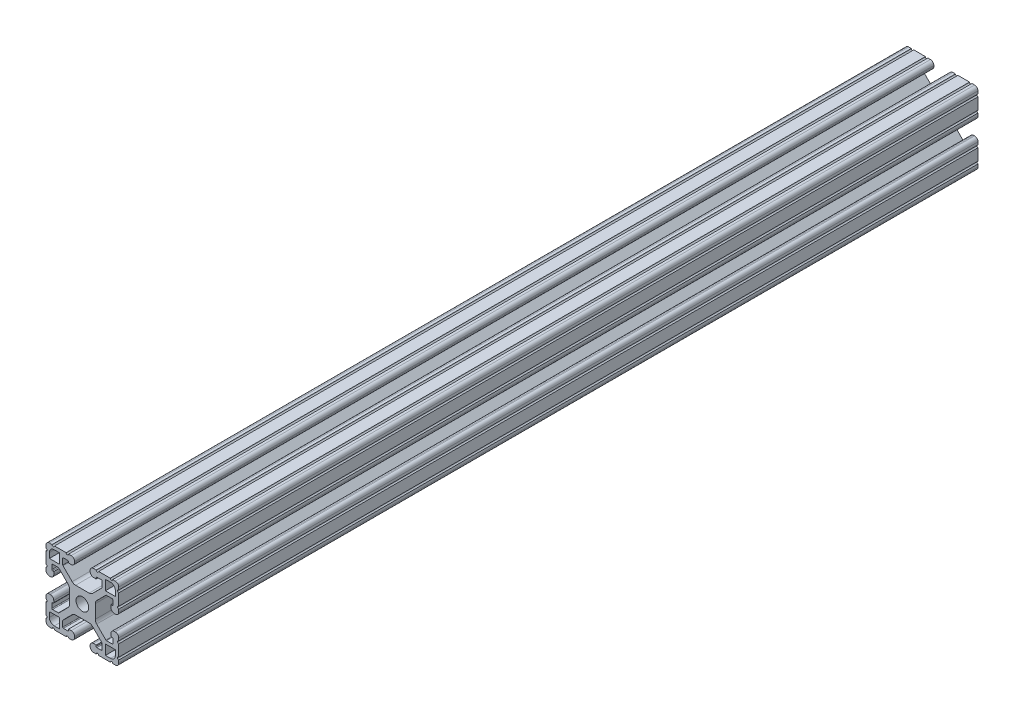
from build123d import *

# Parameters (mm, degrees)
BOSS_EXTRUDE1_DEPTH      = 43.815
BOSS_EXTRUDE1_DEPTH_BACK = 406.4
SKETCH3_W                = 38.1
SKETCH3_H                = 38.1
SKETCH4_W                = 5.207
SKETCH4_H                = 5.207
SKETCH4_R                = 3.3274
CUT_EXTRUDE1_DEPTH       = 452.02034458
CUT_EXTRUDE2_DEPTH       = 452.02034458
FILLET1_R                = 2.54
FILLET2_R                = 1.778
FILLET3_R                = 0.396875


with BuildPart() as part:
    # Sketch3 → Boss-Extrude1 (new, two sides: drawn at the far end of the back side and taken through both)
    with BuildSketch(Plane.XY.offset(-BOSS_EXTRUDE1_DEPTH_BACK)):
        Rectangle(SKETCH3_W, SKETCH3_H)
    extrude(amount=BOSS_EXTRUDE1_DEPTH + BOSS_EXTRUDE1_DEPTH_BACK)

    # Sketch4 → Cut-Extrude1 (cut, through all)
    with BuildSketch(Plane.XY.offset(43.815)):
        Polygon((7.239, 14.986), (4.064, 14.986), (4.064, 19.05), (-4.064, 19.05), (-4.064, 14.986), (-7.239, 14.986), (-7.239, 16.002), (-10.287, 16.002), (-10.287, 12.442261469), (-4.601138531, 6.7564), (4.601138531, 6.7564), (10.287, 12.442261469), (10.287, 16.002), (7.239, 16.002), align=None)
        Polygon((10.287, -12.442261469), (4.601138531, -6.7564), (-4.601138531, -6.7564), (-10.287, -12.442261469), (-10.287, -16.002), (-7.239, -16.002), (-7.239, -14.986), (-4.064, -14.986), (-4.064, -19.05), (4.064, -19.05), (4.064, -14.986), (7.239, -14.986), (7.239, -16.002), (10.287, -16.002), align=None)
        Polygon((-12.442261469, -10.287), (-6.7564, -4.601138531), (-6.7564, 4.601138531), (-12.442261469, 10.287), (-16.002, 10.287), (-16.002, 7.239), (-14.986, 7.239), (-14.986, 4.064), (-19.05, 4.064), (-19.05, -4.064), (-14.986, -4.064), (-14.986, -7.239), (-16.002, -7.239), (-16.002, -10.287), align=None)
        Polygon((14.986, -7.239), (14.986, -4.064), (19.05, -4.064), (19.05, 4.064), (14.986, 4.064), (14.986, 7.239), (16.002, 7.239), (16.002, 10.287), (12.442261469, 10.287), (6.7564, 4.601138531), (6.7564, -4.601138531), (12.442261469, -10.287), (16.002, -10.287), (16.002, -7.239), align=None)
        with Locations((14.6685, 14.6685)):
            Rectangle(SKETCH4_W, SKETCH4_H)
        with Locations((14.6685, -14.6685)):
            Rectangle(SKETCH4_W, SKETCH4_H)
        with Locations((-14.6685, 14.6685)):
            Rectangle(SKETCH4_W, SKETCH4_H)
        with Locations((-14.6685, -14.6685)):
            Rectangle(SKETCH4_W, SKETCH4_H)
        Circle(SKETCH4_R)
    extrude(amount=-CUT_EXTRUDE1_DEPTH, mode=Mode.SUBTRACT)

    # Sketch5 → Cut-Extrude2 (cut, through all)
    with BuildSketch(Plane.XY.offset(43.815)):
        with BuildLine():
            Line((-14.605, 19.05), (-15.875, 19.05))
            ThreePointArc((-15.875, 19.05), (-15.24, 18.415), (-14.605, 19.05))
        make_face()
        with BuildLine():
            Line((-7.239, 19.05), (-8.509, 19.05))
            ThreePointArc((-8.509, 19.05), (-7.874, 18.415), (-7.239, 19.05))
        make_face()
        with BuildLine():
            ThreePointArc((-19.05, 14.605), (-18.415, 15.24), (-19.05, 15.875))
            Line((-19.05, 15.875), (-19.05, 14.605))
        make_face()
        with BuildLine():
            ThreePointArc((-19.05, 7.239), (-18.415, 7.874), (-19.05, 8.509))
            Line((-19.05, 8.509), (-19.05, 7.239))
        make_face()
        with BuildLine():
            ThreePointArc((7.239, 19.05), (7.874, 18.415), (8.509, 19.05))
            Line((8.509, 19.05), (7.239, 19.05))
        make_face()
        with BuildLine():
            ThreePointArc((14.605, 19.05), (15.24, 18.415), (15.875, 19.05))
            Line((15.875, 19.05), (14.605, 19.05))
        make_face()
        with BuildLine():
            Line((19.05, 14.605), (19.05, 15.875))
            ThreePointArc((19.05, 15.875), (18.415, 15.24), (19.05, 14.605))
        make_face()
        with BuildLine():
            Line((19.05, 7.239), (19.05, 8.509))
            ThreePointArc((19.05, 8.509), (18.415, 7.874), (19.05, 7.239))
        make_face()
        with BuildLine():
            ThreePointArc((19.05, -7.239), (18.415, -7.874), (19.05, -8.509))
            Line((19.05, -8.509), (19.05, -7.239))
        make_face()
        with BuildLine():
            ThreePointArc((19.05, -14.605), (18.415, -15.24), (19.05, -15.875))
            Line((19.05, -15.875), (19.05, -14.605))
        make_face()
        with BuildLine():
            Line((14.605, -19.05), (15.875, -19.05))
            ThreePointArc((15.875, -19.05), (15.24, -18.415), (14.605, -19.05))
        make_face()
        with BuildLine():
            Line((7.239, -19.05), (8.509, -19.05))
            ThreePointArc((8.509, -19.05), (7.874, -18.415), (7.239, -19.05))
        make_face()
        with BuildLine():
            ThreePointArc((-7.239, -19.05), (-7.874, -18.415), (-8.509, -19.05))
            Line((-8.509, -19.05), (-7.239, -19.05))
        make_face()
        with BuildLine():
            ThreePointArc((-14.605, -19.05), (-15.24, -18.415), (-15.875, -19.05))
            Line((-15.875, -19.05), (-14.605, -19.05))
        make_face()
        with BuildLine():
            Line((-19.05, -14.605), (-19.05, -15.875))
            ThreePointArc((-19.05, -15.875), (-18.415, -15.24), (-19.05, -14.605))
        make_face()
        with BuildLine():
            Line((-19.05, -7.239), (-19.05, -8.509))
            ThreePointArc((-19.05, -8.509), (-18.415, -7.874), (-19.05, -7.239))
        make_face()
    extrude(amount=-CUT_EXTRUDE2_DEPTH, mode=Mode.SUBTRACT)

    # Fillet1
    fillet1_edges = [part.edges().sort_by_distance(p)[0] for p in [
        (6.7564, -4.601138531, -181.2925),
        (6.7564, 4.601138531, -181.2925),
        (-17.272, 17.272, -181.2925),
        (-17.272, -17.272, -181.2925),
        (17.272, -17.272, -181.2925),
        (17.272, 17.272, -181.2925),
        (-4.601138531, -6.7564, -181.2925),
        (4.601138531, -6.7564, -181.2925),
        (-6.7564, 4.601138531, -181.2925),
        (-6.7564, -4.601138531, -181.2925),
        (4.601138531, 6.7564, -181.2925),
        (-4.601138531, 6.7564, -181.2925),
    ]]
    fillet(fillet1_edges, radius=FILLET1_R)

    # Fillet2
    fillet2_edges = [part.edges().sort_by_distance(p)[0] for p in [
        (14.986, 4.064, -181.2925),
        (19.05, 4.064, -181.2925),
        (19.05, -4.064, -181.2925),
        (14.986, -4.064, -181.2925),
        (4.064, -14.986, -181.2925),
        (4.064, -19.05, -181.2925),
        (-4.064, -19.05, -181.2925),
        (-4.064, -14.986, -181.2925),
        (-14.986, -4.064, -181.2925),
        (-19.05, -4.064, -181.2925),
        (-19.05, 4.064, -181.2925),
        (-14.986, 4.064, -181.2925),
        (-19.05, 19.05, -181.2925),
        (19.05, 19.05, -181.2925),
        (19.05, -19.05, -181.2925),
        (-19.05, -19.05, -181.2925),
        (-4.064, 14.986, -181.2925),
        (-4.064, 19.05, -181.2925),
        (4.064, 19.05, -181.2925),
        (4.064, 14.986, -181.2925),
    ]]
    fillet(fillet2_edges, radius=FILLET2_R)

    # Fillet3
    fillet3_edges = [part.edges().sort_by_distance(p)[0] for p in [
        (12.442261469, 10.287, -181.2925),
        (16.002, 10.287, -181.2925),
        (16.002, 7.239, -181.2925),
        (16.002, -7.239, -181.2925),
        (16.002, -10.287, -181.2925),
        (12.442261469, -10.287, -181.2925),
        (-7.239, -16.002, -181.2925),
        (-10.287, -16.002, -181.2925),
        (-10.287, -12.442261469, -181.2925),
        (10.287, -12.442261469, -181.2925),
        (10.287, -16.002, -181.2925),
        (7.239, -16.002, -181.2925),
        (-16.002, 7.239, -181.2925),
        (-16.002, 10.287, -181.2925),
        (-12.442261469, 10.287, -181.2925),
        (-12.442261469, -10.287, -181.2925),
        (-16.002, -10.287, -181.2925),
        (-14.986, -7.239, -181.2925),
        (-10.287, 12.442261469, -181.2925),
        (-10.287, 16.002, -181.2925),
        (-7.239, 16.002, -181.2925),
        (7.239, 16.002, -181.2925),
        (10.287, 16.002, -181.2925),
        (10.287, 12.442261469, -181.2925),
    ]]
    fillet(fillet3_edges, radius=FILLET3_R)


solid = part.part
